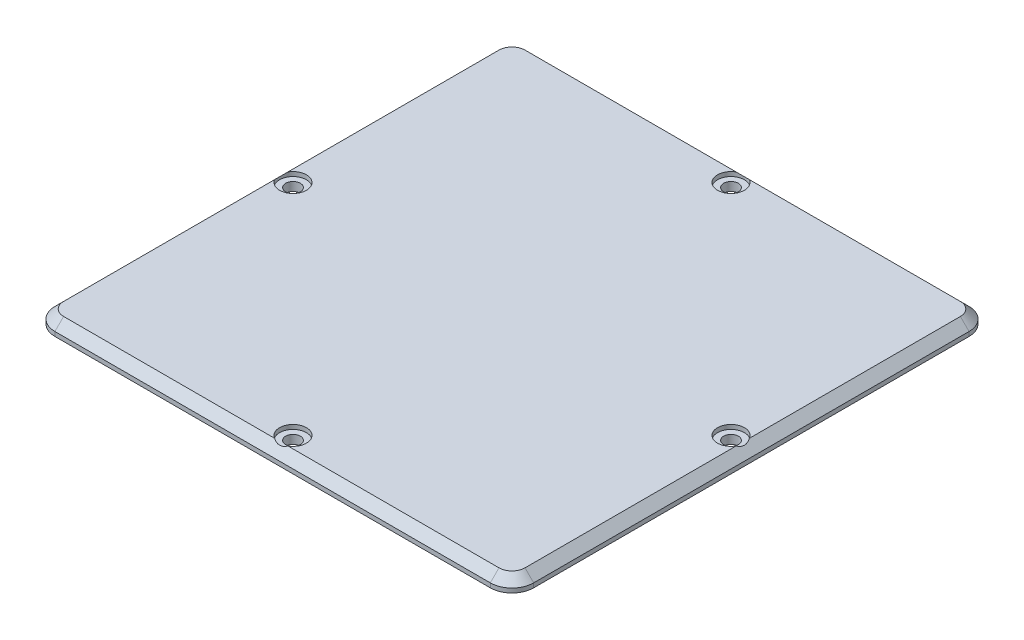
from build123d import *

# Parameters (mm, degrees)
BOSS_EXTRUDE1_DEPTH                                  = 3
CHAMFER1_SIZE                                        = 2
CBORE_FOR_M3_CROSS_RECESS_PAN_HEAD_SCREW_D           = 3.4
CBORE_FOR_M3_CROSS_RECESS_PAN_HEAD_SCREW_DEPTH       = 5
CBORE_FOR_M3_CROSS_RECESS_PAN_HEAD_SCREW_CBORE_D     = 6.2
CBORE_FOR_M3_CROSS_RECESS_PAN_HEAD_SCREW_CBORE_DEPTH = 1
CBORE_FOR_M3_CROSS_RECESS_PAN_HEAD_SCREW_TIP         = 1.021463052
SKETCH10_R                                           = 5
BOSS_EXTRUDE4_DEPTH                                  = 11
CUT_EXTRUDE4_REACH                                   = 165.994
SKETCH12_R                                           = 2.2
CUT_EXTRUDE5_DEPTH                                   = 6


with BuildPart() as part:
    # Sketch1 → Boss-Extrude1 (new body)
    with BuildSketch(Plane(origin=(0, 0, 0), x_dir=(1, 0, 0), z_dir=(0, 1, 0))):
        with BuildLine():
            Line((10.3, 5.3), (110.7, 5.3))
            ThreePointArc((110.7, 5.3), (114.235533906, 6.764466094), (115.7, 10.3))
            Line((115.7, 10.3), (115.7, 110.7))
            ThreePointArc((115.7, 110.7), (114.235533906, 114.235533906), (110.7, 115.7))
            Line((110.7, 115.7), (10.3, 115.7))
            ThreePointArc((10.3, 115.7), (6.764466094, 114.235533906), (5.3, 110.7))
            Line((5.3, 110.7), (5.3, 10.3))
            ThreePointArc((5.3, 10.3), (6.764466094, 6.764466094), (10.3, 5.3))
        make_face()
    extrude(amount=BOSS_EXTRUDE1_DEPTH)

    # Chamfer1
    chamfer1_edges = [part.edges().sort_by_distance(p)[0] for p in [
        (115.7, 3, -60.5),
        (114.235533906, 3, -6.764466094),
        (60.5, 3, -5.3),
        (6.764466094, 3, -6.764466094),
        (5.3, 3, -60.5),
        (6.764466094, 3, -114.235533906),
        (60.5, 3, -115.7),
        (114.235533906, 3, -114.235533906),
    ]]
    chamfer(chamfer1_edges, length=CHAMFER1_SIZE)

    # CBORE for M3 Cross Recess Pan Head Screw1
    with Locations(Plane(origin=(0, 3, 0), x_dir=(1, 0, 0), z_dir=(0, 1, 0))):
        with Locations((60.5, 111), (10, 60.5), (60.5, 10), (111, 60.5)):
            CounterBoreHole(CBORE_FOR_M3_CROSS_RECESS_PAN_HEAD_SCREW_D / 2, CBORE_FOR_M3_CROSS_RECESS_PAN_HEAD_SCREW_CBORE_D / 2, CBORE_FOR_M3_CROSS_RECESS_PAN_HEAD_SCREW_CBORE_DEPTH, depth=CBORE_FOR_M3_CROSS_RECESS_PAN_HEAD_SCREW_DEPTH)
            with Locations((0, 0, -(CBORE_FOR_M3_CROSS_RECESS_PAN_HEAD_SCREW_DEPTH + CBORE_FOR_M3_CROSS_RECESS_PAN_HEAD_SCREW_TIP / 2))):  # 118° drill point
                Cone(0, CBORE_FOR_M3_CROSS_RECESS_PAN_HEAD_SCREW_D / 2, CBORE_FOR_M3_CROSS_RECESS_PAN_HEAD_SCREW_TIP, mode=Mode.SUBTRACT)

    # Sketch10 → Boss-Extrude4 (add)
    with BuildSketch(Plane.XZ):
        with Locations(Location((36.75, -36.764162159, 0), (0, 0, 270))):
            Circle(SKETCH10_R)
        with Locations(Location((36.75, -84.264162159, 0), (0, 0, 270))):
            Circle(SKETCH10_R)
        with Locations(Location((84.25, -84.264162159, 0), (0, 0, 270))):
            Circle(SKETCH10_R)
        with Locations(Location((84.25, -36.764162159, 0), (0, 0, 270))):
            Circle(SKETCH10_R)
    extrude(amount=BOSS_EXTRUDE4_DEPTH)

    # Cut-Extrude4: up to this face of the body (flat: up to its plane)
    cut_extrude4_end = Plane(part.part.faces().sort_by_distance((115.7, 0.5, -60.5))[0])
    # Sketch11 → Cut-Extrude4 (cut, up to the picked face)
    with BuildSketch(Plane(origin=(0, 0, 0), x_dir=(0, 0, -1), z_dir=(1, 0, 0)), mode=Mode.PRIVATE) as cut_extrude4_sk1:
        Polygon((31.764162159, -11), (31.764162159, -6), (89.264162159, -11), align=None)
    cut_extrude4_tool1 = split(extrude(cut_extrude4_sk1.sketch, amount=CUT_EXTRUDE4_REACH, mode=Mode.PRIVATE), bisect_by=cut_extrude4_end, keep=Keep.BOTH, mode=Mode.PRIVATE)
    add(cut_extrude4_tool1.solids().sort_by(Axis((0, -9.333333, -50.930829), (1, 0, 0)))[0], mode=Mode.SUBTRACT)

    # Sketch12 → Cut-Extrude5 (cut)
    with BuildSketch(Plane(origin=(0, -3.213599513, 0.279443436), x_dir=(1, 0, 0), z_dir=(0, -0.9962405881956831, 0.08662961636484202))):
        with Locations(Location((84.25, -84.862639202, 0), (0, 0, 270))):
            Circle(SKETCH12_R)
        with Locations(Location((36.75, -84.862639202, 0), (0, 0, 270))):
            Circle(SKETCH12_R)
        with Locations(Location((36.75, -37.183393282, 0), (0, 0, 270))):
            Circle(SKETCH12_R)
        with Locations(Location((84.25, -37.183393282, 0), (0, 0, 270))):
            Circle(SKETCH12_R)
    extrude(amount=-CUT_EXTRUDE5_DEPTH, mode=Mode.SUBTRACT)


solid = part.part
